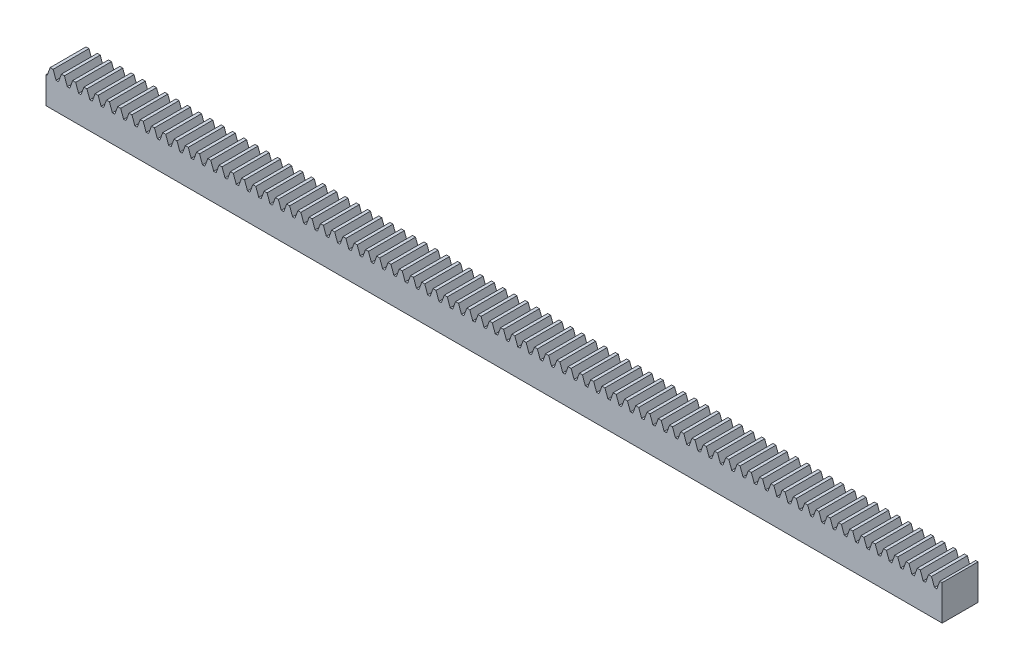
from build123d import *

# Parameters (mm, degrees)
RITNING_1_W          = 250
RITNING_1_H          = 9.8
KUGGST_NGS_MNE_DEPTH = 10
KUGGLUCKA_DEPTH      = 10
LPATTERN_COUNT       = 80
LPATTERN_PITCH       = 3.14159265


with BuildPart() as part:
    # Ritning 1 → Kuggstångsämne (new body)
    with BuildSketch(Plane.XY):
        with Locations((0.9, 0)):
            Rectangle(RITNING_1_W, RITNING_1_H)
    extrude(amount=KUGGST_NGS_MNE_DEPTH)

    # Ritning 2 → Kugglucka (cut)
    with BuildSketch(Plane.XY.offset(10)):
        with BuildLine():
            Line((-124.438289352, 2.65), (-123.761710648, 2.65))
            Line((-123.761710648, 2.65), (-122.942777621, 4.9))
            Line((-122.942777621, 4.9), (-124.1, 6.057222379))
            Line((-124.1, 6.057222379), (-125.257222379, 4.9))
            add(Edge.make_bspline(
                [(-125.257222379, 4.9), (-124.984244704, 4.15), (-124.711267028, 3.4), (-124.438289352, 2.65)],
                knots=[0, 0, 0, 0, 1, 1, 1, 1], degree=3))
        make_face()
    kugglucka = extrude(amount=-KUGGLUCKA_DEPTH, mode=Mode.SUBTRACT)

    # LPattern: Kugglucka ×80
    with Locations(*[(i * LPATTERN_PITCH, 0, 0) for i in range(1, LPATTERN_COUNT)]):
        add(kugglucka, mode=Mode.SUBTRACT)


solid = part.part
